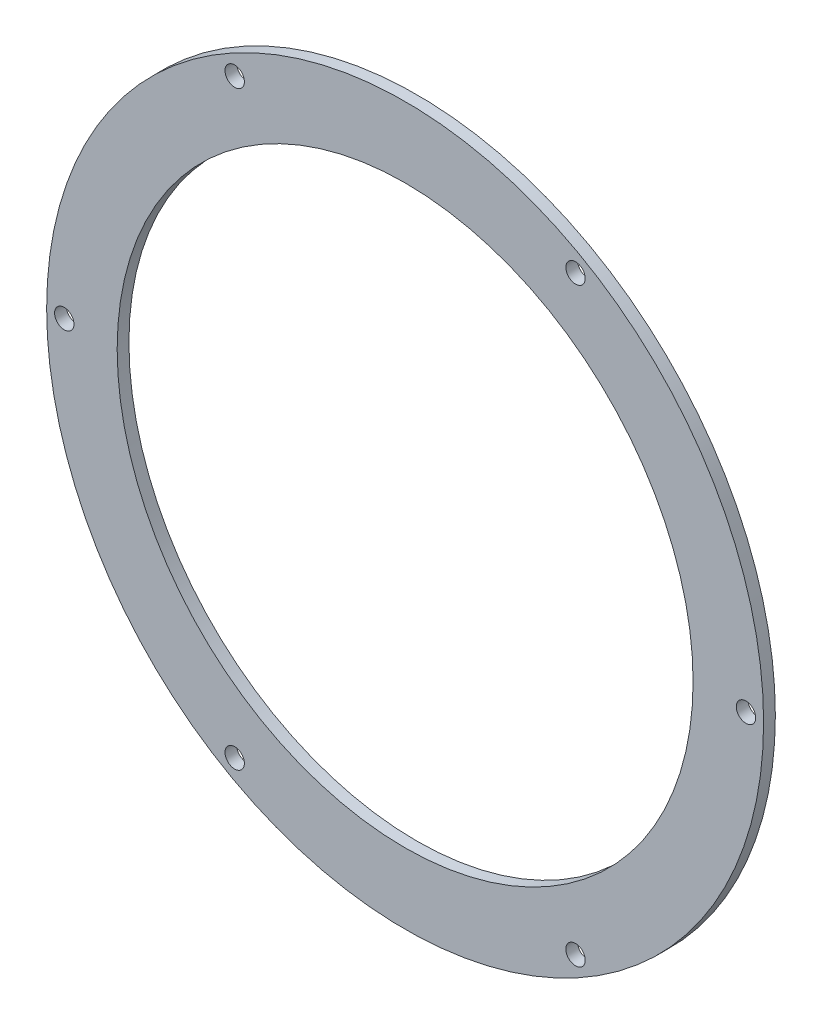
from build123d import *

# Parameters (mm, degrees)
STATOR_CLAMP_START  = 20
SKETCH_1_R          = 61
SKETCH_1_R_2        = 49
STATOR_CLAMP_DEPTH  = 2
SKETCH_2_R          = 1.65
THROUGH_HOLES_DEPTH = 100


with BuildPart() as part:
    # Эскиз1 → Stator_clamp (new body)
    with BuildSketch(Plane.XY.offset(STATOR_CLAMP_START)):
        Circle(SKETCH_1_R)
        Circle(SKETCH_1_R_2, mode=Mode.SUBTRACT)
    extrude(amount=STATOR_CLAMP_DEPTH)

    # Эскиз2 → Through_holes (cut, symmetric)
    with BuildSketch(Plane.XY):
        with Locations((58, 0)):
            Circle(SKETCH_2_R)
        with Locations((29, 50.229473419)):
            Circle(SKETCH_2_R)
        with Locations((-29, 50.229473419)):
            Circle(SKETCH_2_R)
        with Locations((-58, 0)):
            Circle(SKETCH_2_R)
        with Locations((-29, -50.229473419)):
            Circle(SKETCH_2_R)
        with Locations((29, -50.229473419)):
            Circle(SKETCH_2_R)
    extrude(amount=THROUGH_HOLES_DEPTH, both=True, mode=Mode.SUBTRACT)


solid = part.part
